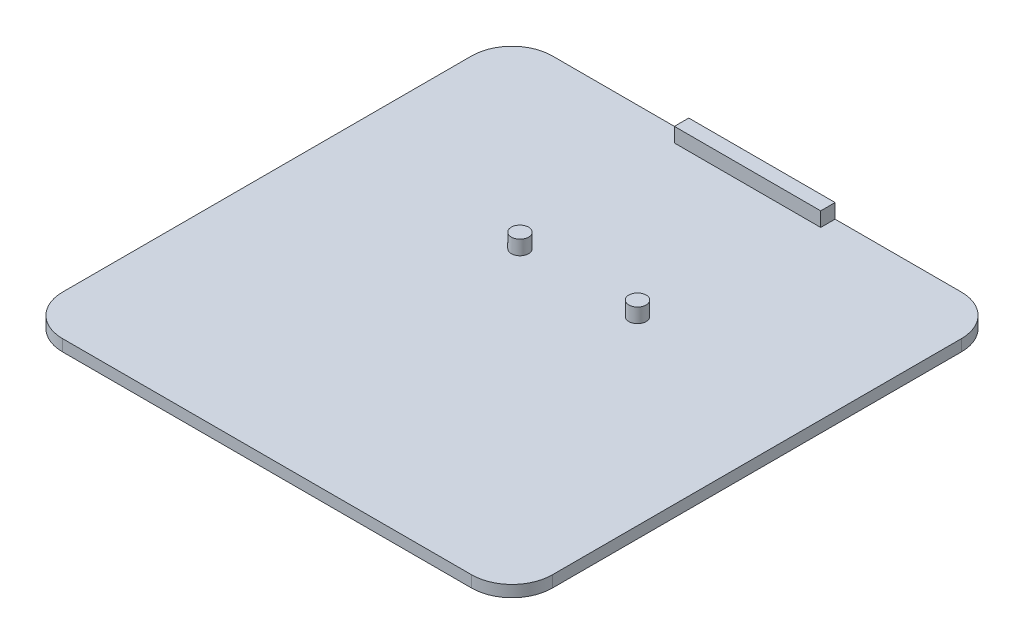
from build123d import *

# Parameters (mm, degrees)
BOSS_EXTRUDE1_DEPTH = 2
SKETCH2_R           = 1.5
SKETCH2_W           = 25.4
SKETCH2_H           = 2.5
BOSS_EXTRUDE2_DEPTH = 2.5


with BuildPart() as part:
    # Sketch1 → Boss-Extrude1 (new body)
    with BuildSketch(Plane(origin=(0, 0, 0), x_dir=(1, 0, 0), z_dir=(0, 1, 0))):
        with BuildLine():
            Line((-35.892490242, -26.522279469), (35.107509758, -26.522279469))
            ThreePointArc((35.107509758, -26.522279469), (40.057257226, -24.472026937), (42.107509758, -19.522279469))
            Line((42.107509758, -19.522279469), (42.107509758, 51.477720531))
            ThreePointArc((42.107509758, 51.477720531), (40.057257226, 56.427467999), (35.107509758, 58.477720531))
            Line((35.107509758, 58.477720531), (-35.892490242, 58.477720531))
            ThreePointArc((-35.892490242, 58.477720531), (-40.84223771, 56.427467999), (-42.892490242, 51.477720531))
            Line((-42.892490242, 51.477720531), (-42.892490242, -19.522279469))
            ThreePointArc((-42.892490242, -19.522279469), (-40.84223771, -24.472026937), (-35.892490242, -26.522279469))
        make_face()
    extrude(amount=BOSS_EXTRUDE1_DEPTH)

    # Sketch2 → Boss-Extrude2 (add)
    with BuildSketch(Plane(origin=(0, 2, 0), x_dir=(1, 0, 0), z_dir=(0, 1, 0))):
        with Locations(Location((-9.711578579, 26.678960322, 0), (0, 0, 90))):
            Circle(SKETCH2_R)
        with Locations(Location((10.688421421, 26.678960322, 0), (0, 0, 90))):
            Circle(SKETCH2_R)
        with Locations((0.488421421, 57.227720531)):
            Rectangle(SKETCH2_W, SKETCH2_H)
    extrude(amount=BOSS_EXTRUDE2_DEPTH)


solid = part.part
